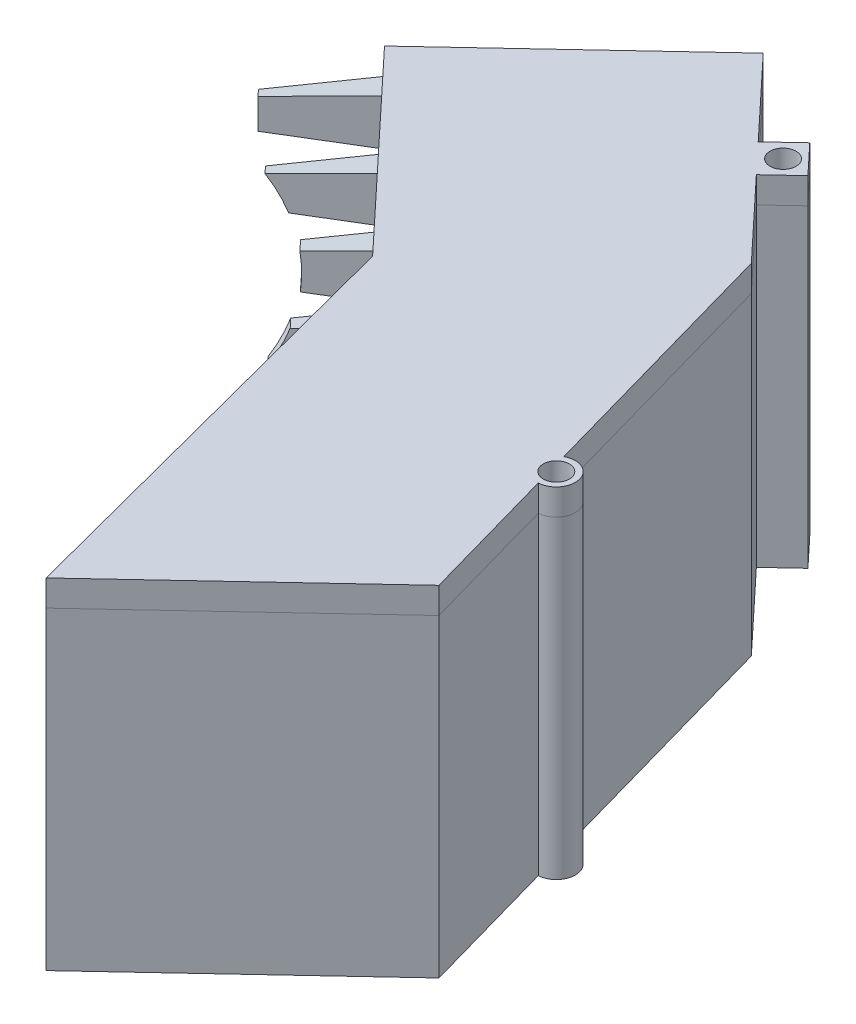
from build123d import *

# Parameters (mm, degrees)
SKETCH1_R                     = 3.175
BOSS_EXTRUDE2_DEPTH           = 76.2
SKETCH1_5_R                   = 3.175
BOSS_EXTRUDE3_DEPTH           = 6.35
SKETCH5_R                     = 3.175
BOSS_EXTRUDE4_DEPTH           = 6.35
SKETCH6_W                     = 50.8
SKETCH6_H                     = 50.8
CUT_EXTRUDE1_DEPTH            = 21.59
SKETCH7_W                     = 5.86068256
SKETCH7_H                     = 11.122345704
BOSS_EXTRUDE5_DEPTH           = 21.59
BOSS_EXTRUDE5_DRAFT           = 5
BOSS_EXTRUDE5_PROFILE_2_DEPTH = 21.59
BOSS_EXTRUDE5_PROFILE_2_DRAFT = 5
BOSS_EXTRUDE5_PROFILE_3_DEPTH = 21.59
BOSS_EXTRUDE5_PROFILE_3_DRAFT = 5
SKETCH7_H_2                   = 11.122345705
BOSS_EXTRUDE5_PROFILE_4_DEPTH = 21.59
BOSS_EXTRUDE5_PROFILE_4_DRAFT = 5
BOSS_EXTRUDE5_PROFILE_5_DEPTH = 21.59
BOSS_EXTRUDE5_PROFILE_5_DRAFT = 5
SKETCH10_R                    = 36.051864109
CUT_EXTRUDE2_DEPTH            = 21.59


with BuildPart() as part:
    # Sketch1 → Boss-Extrude2 (new body)
    with BuildSketch(Plane(origin=(0, 0, 0), x_dir=(1, 0, 0), z_dir=(0, 1, 0))):
        with BuildLine():
            Line((-4.208751998, -43.475305064), (45.017746951, 2.631829887))
            Line((45.017746951, 2.631829887), (35.550660053, 36.209226482))
            ThreePointArc((35.550660053, 36.209226482), (39.762177432, 42.05307025), (33.11828595, 44.83625091))
            Line((33.11828595, 44.83625091), (15.243844224, 108.232438689))
            Line((15.243844224, 108.232438689), (-2.783728935, 127.479661752))
            Line((-2.783728935, 127.479661752), (3.678966496, 133.532831827))
            Line((3.678966496, 133.532831827), (-3.005742225, 140.669792455))
            Line((-3.005742225, 140.669792455), (-9.468437655, 134.61662238))
            Line((-9.468437655, 134.61662238), (-27.496010814, 153.863845442))
            Line((-27.496010814, 153.863845442), (-74.966911398, 109.401060841))
            Line((-74.966911398, 109.401060841), (-32.227053049, 63.769650553))
            Line((-32.227053049, 63.769650553), (-4.208751998, -43.475305064))
        make_face()
        with Locations((35.334305242, 40.804639607)):
            Circle(SKETCH1_R, mode=Mode.SUBTRACT)
        with BuildLine():
            Line((-27.946524097, 65.532765046), (-68.844709626, 109.197904706))
            Line((-68.844709626, 109.197904706), (-27.496010814, 147.926436632))
            Line((-27.496010814, 147.926436632), (12.111157264, 105.390011693))
            Line((12.111157264, 105.390011693), (34.544848217, 24.491577435))
            ThreePointArc((34.544848217, 24.491577435), (36.285698832, 19.303992732), (36.875100326, 13.863937421))
            ThreePointArc((36.875100326, 13.863937421), (14.585843996, -11.34485616), (-13.162952731, 7.689284266))
            Line((-13.162952731, 7.689284266), (-27.946524097, 65.532765046))
        make_face(mode=Mode.SUBTRACT)
        with Locations((-2.894634056, 134.074815557)):
            Circle(SKETCH1_R, mode=Mode.SUBTRACT)
    extrude(amount=BOSS_EXTRUDE2_DEPTH)

    # Sketch1<5> → Boss-Extrude3 (add)
    with BuildSketch(Plane(origin=(0, 0, 0), x_dir=(1, 0, 0), z_dir=(0, 1, 0))):
        with BuildLine():
            Line((-27.496010814, 147.926436632), (-68.844709626, 109.197904706))
            Line((-68.844709626, 109.197904706), (-27.946524097, 65.532765046))
            Line((-27.946524097, 65.532765046), (-13.162952731, 7.689284266))
            ThreePointArc((-13.162952731, 7.689284266), (3.03743719, 37.821521623), (34.544848217, 24.491577435))
            Line((34.544848217, 24.491577435), (12.111157264, 105.390011693))
            Line((12.111157264, 105.390011693), (-27.496010814, 147.926436632))
        make_face()
        with Locations((-32.808552916, 77.429328599)):
            Circle(SKETCH1_5_R, mode=Mode.SUBTRACT)
        with Locations((-1.199981142, 109.041759799)):
            Circle(SKETCH1_5_R, mode=Mode.SUBTRACT)
    extrude(amount=BOSS_EXTRUDE3_DEPTH)

    # Sketch6 → Cut-Extrude1 (cut)
    with BuildSketch(Plane(origin=(14.64974053, 0, -13.721421958), x_dir=(0.683604049055853, 0, 0.729853070223345), z_dir=(-0.729853070223345, 0, 0.683604049055853))):
        with Locations((-99.833701757, 41.275)):
            Rectangle(SKETCH6_W, SKETCH6_H)
    extrude(amount=-CUT_EXTRUDE1_DEPTH, mode=Mode.SUBTRACT)


with BuildPart() as body_2:
    # Sketch5 → Boss-Extrude4 (new body)
    with BuildSketch(Plane(origin=(0, 76.2, 0), x_dir=(1, 0, 0), z_dir=(0, 1, 0))):
        with BuildLine():
            Line((45.017746951, 2.631829887), (35.550660053, 36.209226482))
            ThreePointArc((35.550660053, 36.209226482), (39.762177432, 42.05307025), (33.11828595, 44.83625091))
            Line((33.11828595, 44.83625091), (15.243844224, 108.232438689))
            Line((15.243844224, 108.232438689), (-2.783728935, 127.479661752))
            Line((-2.783728935, 127.479661752), (3.678966496, 133.532831827))
            Line((3.678966496, 133.532831827), (-3.005742225, 140.669792455))
            Line((-3.005742225, 140.669792455), (-9.468437655, 134.61662238))
            Line((-9.468437655, 134.61662238), (-27.496010814, 153.863845442))
            Line((-27.496010814, 153.863845442), (-74.966911398, 109.401060841))
            Line((-74.966911398, 109.401060841), (-32.227053049, 63.769650553))
            Line((-32.227053049, 63.769650553), (-4.208751998, -43.475305064))
            Line((-4.208751998, -43.475305064), (45.017746951, 2.631829887))
        make_face()
        with Locations((-2.894634056, 134.074815557)):
            Circle(SKETCH5_R, mode=Mode.SUBTRACT)
        with Locations((35.334305242, 40.804639607)):
            Circle(SKETCH5_R, mode=Mode.SUBTRACT)
    extrude(amount=BOSS_EXTRUDE4_DEPTH)


with BuildPart() as boss_extrude5_tool:
    # Sketch7 → Boss-Extrude5 (with draft: the straight prism first)
    with BuildSketch(Plane(origin=(14.64974053, 0, -13.721421958), x_dir=(0.683604049055853, 0, 0.729853070223345), z_dir=(-0.729853070223345, 0, 0.683604049055853))):
        with Locations((-128.164043037, 70.606947953)):
            Rectangle(SKETCH7_W, SKETCH7_H)
    extrude(amount=BOSS_EXTRUDE5_DEPTH)
    # Boss-Extrude5: the draft: its side faces are tilted about the plane it starts from
    boss_extrude5_sides = [boss_extrude5_tool.faces().sort_by_distance(p)[0] for p in [
        (-82.845675291, 70.606947953, -102.021555132),
        (-80.842482126, 65.045775101, -99.882836552),
        (-78.839288962, 70.606947953, -97.744117972),
        (-80.842482126, 76.168120805, -99.882836552),
    ]]
    draft(boss_extrude5_sides, Plane(origin=(14.64974053, 0, -13.721421958), x_dir=(0.683604049055853, 0, 0.729853070223345), z_dir=(-0.729853070223345, 0, 0.683604049055853)), BOSS_EXTRUDE5_DRAFT)


with BuildPart() as part_1:
    add(part.part)

    # Boss-Extrude5: add boss_extrude5_tool
    add(boss_extrude5_tool.part)


with BuildPart() as boss_extrude5_profile_2_tool:
    # Sketch7 → Boss-Extrude5 profile 2 (with draft: the straight prism first)
    with BuildSketch(Plane(origin=(14.64974053, 0, -13.721421958), x_dir=(0.683604049055853, 0, 0.729853070223345), z_dir=(-0.729853070223345, 0, 0.683604049055853))):
        with Locations((-128.164043037, 54.345504178)):
            Rectangle(SKETCH7_W, SKETCH7_H)
    extrude(amount=BOSS_EXTRUDE5_PROFILE_2_DEPTH)
    # Boss-Extrude5 profile 2: the draft: its side faces are tilted about the plane it starts from
    boss_extrude5_profile_2_sides = [boss_extrude5_profile_2_tool.faces().sort_by_distance(p)[0] for p in [
        (-80.842482126, 48.784331326, -99.882836552),
        (-78.839288962, 54.345504178, -97.744117972),
        (-80.842482126, 59.90667703, -99.882836552),
        (-82.845675291, 54.345504178, -102.021555132),
    ]]
    draft(boss_extrude5_profile_2_sides, Plane(origin=(14.64974053, 0, -13.721421958), x_dir=(0.683604049055853, 0, 0.729853070223345), z_dir=(-0.729853070223345, 0, 0.683604049055853)), BOSS_EXTRUDE5_PROFILE_2_DRAFT)


with BuildPart() as part_2:
    add(part_1.part)

    # Boss-Extrude5 profile 2: add boss_extrude5_profile_2_tool
    add(boss_extrude5_profile_2_tool.part)


with BuildPart() as boss_extrude5_profile_3_tool:
    # Sketch7 → Boss-Extrude5 profile 3 (with draft: the straight prism first)
    with BuildSketch(Plane(origin=(14.64974053, 0, -13.721421958), x_dir=(0.683604049055853, 0, 0.729853070223345), z_dir=(-0.729853070223345, 0, 0.683604049055853))):
        with Locations((-128.164043037, 38.084060403)):
            Rectangle(SKETCH7_W, SKETCH7_H)
    extrude(amount=BOSS_EXTRUDE5_PROFILE_3_DEPTH)
    # Boss-Extrude5 profile 3: the draft: its side faces are tilted about the plane it starts from
    boss_extrude5_profile_3_sides = [boss_extrude5_profile_3_tool.faces().sort_by_distance(p)[0] for p in [
        (-80.842482126, 32.522887551, -99.882836552),
        (-78.839288962, 38.084060403, -97.744117972),
        (-80.842482126, 43.645233255, -99.882836552),
        (-82.845675291, 38.084060403, -102.021555132),
    ]]
    draft(boss_extrude5_profile_3_sides, Plane(origin=(14.64974053, 0, -13.721421958), x_dir=(0.683604049055853, 0, 0.729853070223345), z_dir=(-0.729853070223345, 0, 0.683604049055853)), BOSS_EXTRUDE5_PROFILE_3_DRAFT)


with BuildPart() as part_3:
    add(part_2.part)

    # Boss-Extrude5 profile 3: add boss_extrude5_profile_3_tool
    add(boss_extrude5_profile_3_tool.part)


with BuildPart() as boss_extrude5_profile_4_tool:
    # Sketch7 → Boss-Extrude5 profile 4 (with draft: the straight prism first)
    with BuildSketch(Plane(origin=(14.64974053, 0, -13.721421958), x_dir=(0.683604049055853, 0, 0.729853070223345), z_dir=(-0.729853070223345, 0, 0.683604049055853))):
        with Locations((-128.164043037, 21.822616628)):
            Rectangle(SKETCH7_W, SKETCH7_H_2)
    extrude(amount=BOSS_EXTRUDE5_PROFILE_4_DEPTH)
    # Boss-Extrude5 profile 4: the draft: its side faces are tilted about the plane it starts from
    boss_extrude5_profile_4_sides = [boss_extrude5_profile_4_tool.faces().sort_by_distance(p)[0] for p in [
        (-80.842482126, 16.261443775, -99.882836552),
        (-78.839288962, 21.822616627, -97.744117972),
        (-80.842482126, 27.38378948, -99.882836552),
        (-82.845675291, 21.822616627, -102.021555132),
    ]]
    draft(boss_extrude5_profile_4_sides, Plane(origin=(14.64974053, 0, -13.721421958), x_dir=(0.683604049055853, 0, 0.729853070223345), z_dir=(-0.729853070223345, 0, 0.683604049055853)), BOSS_EXTRUDE5_PROFILE_4_DRAFT)


with BuildPart() as part_4:
    add(part_3.part)

    # Boss-Extrude5 profile 4: add boss_extrude5_profile_4_tool
    add(boss_extrude5_profile_4_tool.part)


with BuildPart() as boss_extrude5_profile_5_tool:
    # Sketch7 → Boss-Extrude5 profile 5 (with draft: the straight prism first)
    with BuildSketch(Plane(origin=(14.64974053, 0, -13.721421958), x_dir=(0.683604049055853, 0, 0.729853070223345), z_dir=(-0.729853070223345, 0, 0.683604049055853))):
        with Locations((-128.164043037, 5.561172852)):
            Rectangle(SKETCH7_W, SKETCH7_H)
    extrude(amount=BOSS_EXTRUDE5_PROFILE_5_DEPTH)
    # Boss-Extrude5 profile 5: the draft: its side faces are tilted about the plane it starts from
    boss_extrude5_profile_5_sides = [boss_extrude5_profile_5_tool.faces().sort_by_distance(p)[0] for p in [
        (-80.842482126, 0, -99.882836552),
        (-78.839288962, 5.561172852, -97.744117972),
        (-80.842482126, 11.122345704, -99.882836552),
        (-82.845675291, 5.561172852, -102.021555132),
    ]]
    draft(boss_extrude5_profile_5_sides, Plane(origin=(14.64974053, 0, -13.721421958), x_dir=(0.683604049055853, 0, 0.729853070223345), z_dir=(-0.729853070223345, 0, 0.683604049055853)), BOSS_EXTRUDE5_PROFILE_5_DRAFT)


with BuildPart() as part_5:
    add(part_4.part)

    # Boss-Extrude5 profile 5: add boss_extrude5_profile_5_tool
    add(boss_extrude5_profile_5_tool.part)

    # Sketch10 → Cut-Extrude2 (cut)
    with BuildSketch(Plane(origin=(-89.616651928, 0, -95.679638883), x_dir=(-0.7298530702233451, 0, 0.683604049055853), z_dir=(-0.683604049055853, 0, -0.7298530702233451))):
        with Locations((30.057024975, 37.74518963)):
            Circle(SKETCH10_R)
    extrude(amount=-CUT_EXTRUDE2_DEPTH, mode=Mode.SUBTRACT)


solid = Compound([body_2.part, part_5.part])
